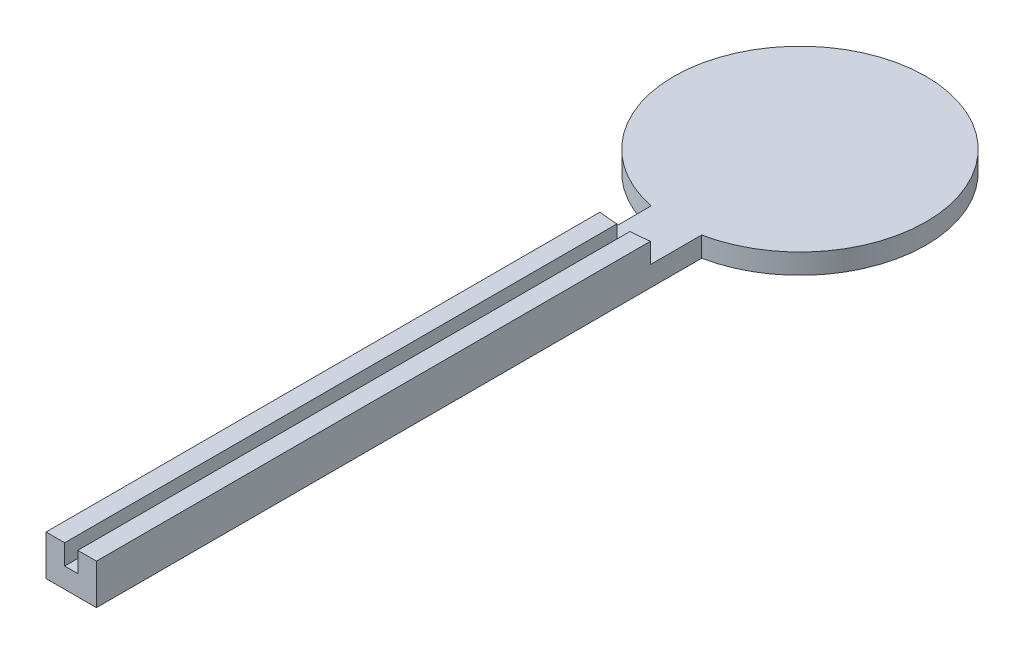
from build123d import *

# Parameters (mm, degrees)
BOSS_EXTRUDE1_DEPTH = 4
SKETCH3_R           = 17.5
CUT_EXTRUDE1_DEPTH  = 2
CUT_EXTRUDE2_DEPTH  = 2


with BuildPart() as part:
    # Sketch1 → Boss-Extrude1 (new body)
    with BuildSketch(Plane(origin=(0, 0, 0), x_dir=(1, 0, 0), z_dir=(0, 1, 0))):
        with BuildLine():
            Line((2.5, -72.247448714), (-2.5, -72.247448714))
            Line((-2.5, -72.247448714), (-2.5, -12.247448714))
            ThreePointArc((-2.5, -12.247448714), (0, 12.5), (2.5, -12.247448714))
            Line((2.5, -12.247448714), (2.5, -72.247448714))
        make_face()
    extrude(amount=BOSS_EXTRUDE1_DEPTH)

    # Sketch3 → Cut-Extrude1 (cut)
    with BuildSketch(Plane(origin=(0, 4, 0), x_dir=(1, 0, 0), z_dir=(0, 1, 0))):
        Circle(SKETCH3_R)
    extrude(amount=-CUT_EXTRUDE1_DEPTH, mode=Mode.SUBTRACT)

    # Sketch4 → Cut-Extrude2 (cut)
    with BuildSketch(Plane(origin=(0, 4, 0), x_dir=(1, 0, 0), z_dir=(0, 1, 0))):
        with BuildLine():
            Line((-0.65, -17.487924405), (-0.65, -72.247448714))
            Line((-0.65, -72.247448714), (0.65, -72.247448714))
            Line((0.65, -72.247448714), (0.65, -17.487924405))
            ThreePointArc((0.65, -17.487924405), (0, -17.5), (-0.65, -17.487924405))
        make_face()
    extrude(amount=-CUT_EXTRUDE2_DEPTH, mode=Mode.SUBTRACT)


solid = part.part
